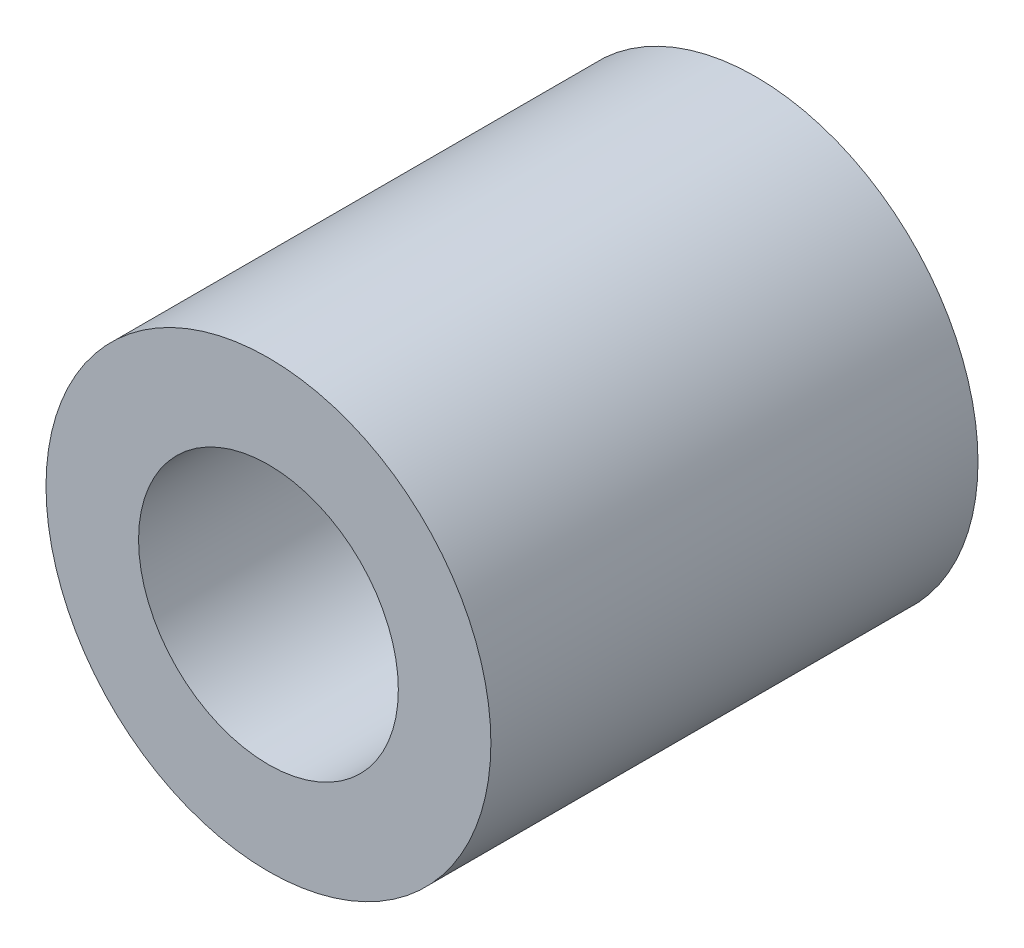
from build123d import *

# Parameters (mm, degrees)
SKETCH1_R           = 6.85
SKETCH1_R_2         = 4
BOSS_EXTRUDE1_DEPTH = 15


with BuildPart() as part:
    # Sketch1 → Boss-Extrude1 (new body)
    with BuildSketch(Plane.XY):
        Circle(SKETCH1_R)
        Circle(SKETCH1_R_2, mode=Mode.SUBTRACT)
    extrude(amount=BOSS_EXTRUDE1_DEPTH)


solid = part.part
